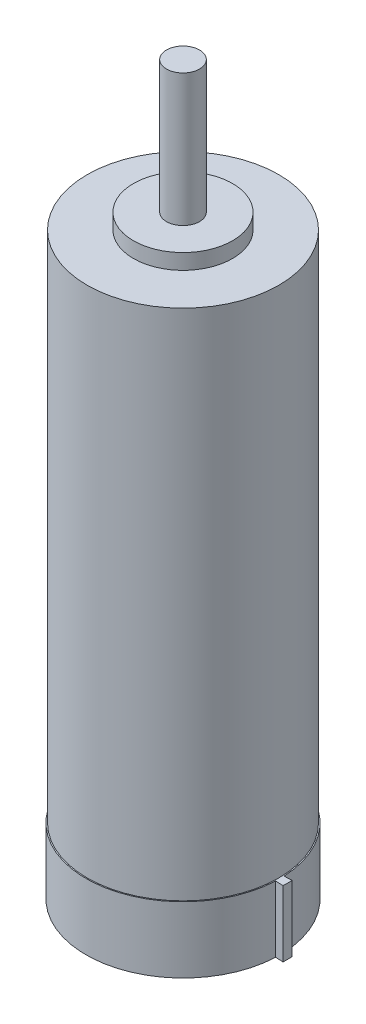
from build123d import *

# Parameters (mm, degrees)
SKETCH_1_R               = 8.8
EXTRUDE_1_DEPTH          = 6
SKETCH_6_W               = 0.7
SKETCH_6_H               = 6
REVOLVE_1_ANGLE          = 5
PATTERN_CIRCULAR_5_COUNT = 2
SKETCH_7_R               = 8.7
EXTRUDE_10_DEPTH         = 46.6
SKETCH_8_R               = 4.5
EXTRUDE_11_DEPTH         = 1.4
SKETCH_9_R               = 1.5
EXTRUDE_12_DEPTH         = 12
F_2_0MM_1_D              = 2
F_2_0MM_1_DEPTH          = 5
F_2_0MM_1_TIP            = 0.600860619
F_2_0MM_2_D              = 2
F_2_0MM_2_DEPTH          = 5
F_2_0MM_2_TIP            = 0.600860619


with BuildPart() as part:
    # 草图1 → 凸台-拉伸1 (new body)
    with BuildSketch(Plane(origin=(0, 0, 0), x_dir=(1, 0, 0), z_dir=(0, 1, 0))):
        with Locations(Location((0, 0, 0), (0, 0, 270))):
            Circle(SKETCH_1_R)
    extrude(amount=EXTRUDE_1_DEPTH)

    # 草图6 → 旋转1 (revolve, symmetric)
    with BuildSketch(Plane.XY) as revolve_1_sk:
        with Locations((-9.15, 3)):
            Rectangle(SKETCH_6_W, SKETCH_6_H)
    revolve_1 = revolve(axis=Axis((0, 1.183639986, 0), (0, -1, 0)), revolution_arc=REVOLVE_1_ANGLE / 2)
    revolve_1 = revolve_1 + revolve(revolve_1_sk.sketch, axis=Axis((0, 1.183639986, 0), (0, 1, 0)), revolution_arc=REVOLVE_1_ANGLE / 2)

    # 阵列(圆周)5: 旋转1 ×2 about axis
    pattern_circular_5_axis = Axis((0, 0, 0), (0, 1, 0))
    for i in range(1, PATTERN_CIRCULAR_5_COUNT):
        add(revolve_1.rotate(pattern_circular_5_axis, i * 360 / PATTERN_CIRCULAR_5_COUNT))

    # 草图7 → 凸台-拉伸10 (add)
    with BuildSketch(Plane(origin=(0, 6, 0), x_dir=(1, 0, 0), z_dir=(0, 1, 0))):
        with Locations(Location((0, 0, 0), (0, 0, 270))):
            Circle(SKETCH_7_R)
    extrude(amount=EXTRUDE_10_DEPTH)

    # 草图8 → 凸台-拉伸11 (add)
    with BuildSketch(Plane(origin=(0, 52.6, 0), x_dir=(1, 0, 0), z_dir=(0, 1, 0))):
        with Locations(Location((0, 0, 0), (0, 0, 270))):
            Circle(SKETCH_8_R)
    extrude(amount=EXTRUDE_11_DEPTH)

    # 草图9 → 凸台-拉伸12 (add)
    with BuildSketch(Plane(origin=(0, 54, 0), x_dir=(1, 0, 0), z_dir=(0, 1, 0))):
        with Locations(Location((0, 0, 0), (0, 0, 270))):
            Circle(SKETCH_9_R)
    extrude(amount=EXTRUDE_12_DEPTH)

    # Ø2.0mm 暗销孔1
    with Locations(Plane(origin=(-6.72, 0, 0), x_dir=(0, 0, -1), z_dir=(0, -1, 0))):
        with Locations((0, 0)):
            Hole(F_2_0MM_1_D / 2, depth=F_2_0MM_1_DEPTH)
            with Locations((0, 0, -(F_2_0MM_1_DEPTH + F_2_0MM_1_TIP / 2))):  # 118° drill point
                Cone(0, F_2_0MM_1_D / 2, F_2_0MM_1_TIP, mode=Mode.SUBTRACT)

    # Ø2.0mm 暗销孔2
    with Locations(Plane(origin=(6.72, 0, 0), x_dir=(0, 0, -1), z_dir=(0, -1, 0))):
        with Locations((0, 0)):
            Hole(F_2_0MM_2_D / 2, depth=F_2_0MM_2_DEPTH)
            with Locations((0, 0, -(F_2_0MM_2_DEPTH + F_2_0MM_2_TIP / 2))):  # 118° drill point
                Cone(0, F_2_0MM_2_D / 2, F_2_0MM_2_TIP, mode=Mode.SUBTRACT)


solid = part.part
